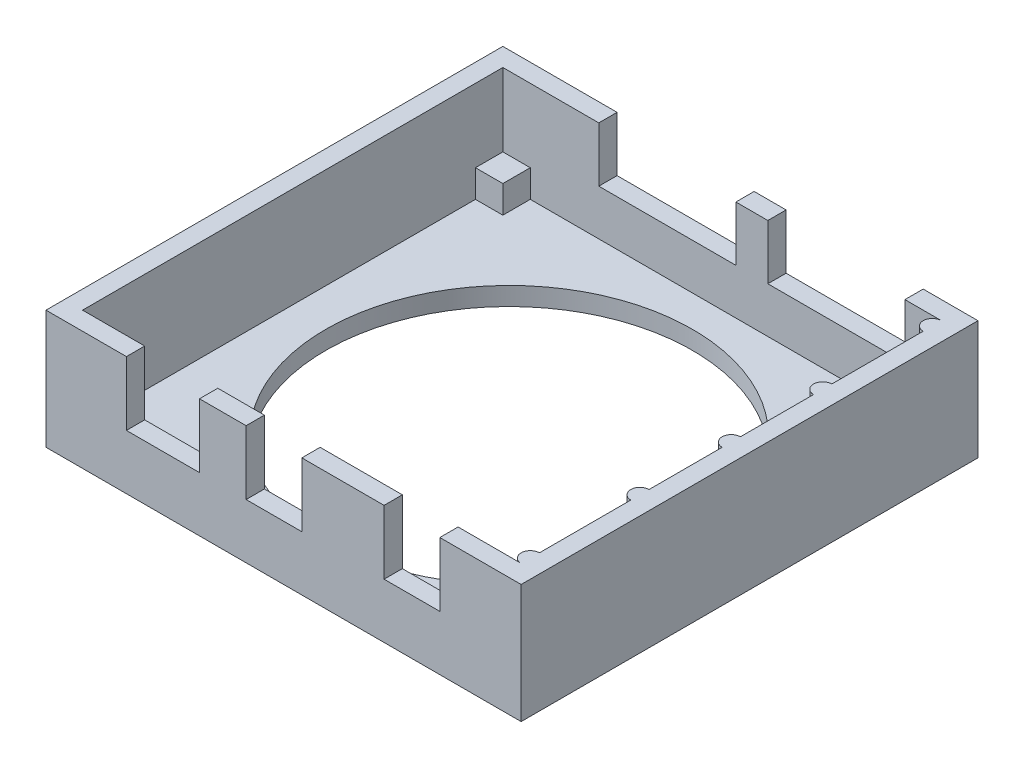
from build123d import *

# Parameters (mm, degrees)
SKETCH1_W           = 52
SKETCH1_H           = 50
BOSS_EXTRUDE1_DEPTH = 13
SKETCH2_W           = 48
SKETCH2_H           = 46
CUT_EXTRUDE1_DEPTH  = 11
SKETCH3_W           = 6.1
SKETCH3_H           = 2
SKETCH3_W_2         = 8
CUT_EXTRUDE2_DEPTH  = 7
SKETCH4_W           = 3
SKETCH4_H           = 3
BOSS_EXTRUDE2_DEPTH = 3
SKETCH5_R           = 1
BOSS_EXTRUDE3_DEPTH = 11
SKETCH13_W          = 15
SKETCH13_H          = 2
CUT_EXTRUDE4_DEPTH  = 6
SKETCH12_R          = 20.065170359
CUT_EXTRUDE3_DEPTH  = 10


with BuildPart() as part:
    # Sketch1 → Boss-Extrude1 (new body)
    with BuildSketch(Plane(origin=(0, 0, 0), x_dir=(1, 0, 0), z_dir=(0, 1, 0))):
        with Locations((26, 25)):
            Rectangle(SKETCH1_W, SKETCH1_H)
    extrude(amount=BOSS_EXTRUDE1_DEPTH)

    # Sketch2 → Cut-Extrude1 (cut)
    with BuildSketch(Plane(origin=(0, 13, 0), x_dir=(1, 0, 0), z_dir=(0, 1, 0))):
        with Locations((26, 25)):
            Rectangle(SKETCH2_W, SKETCH2_H)
    extrude(amount=-CUT_EXTRUDE1_DEPTH, mode=Mode.SUBTRACT)

    # Sketch3 → Cut-Extrude2 (cut)
    with BuildSketch(Plane(origin=(0, 13, 0), x_dir=(1, 0, 0), z_dir=(0, 1, 0))):
        with Locations((40.05, 1)):
            Rectangle(SKETCH3_W, SKETCH3_H)
        with Locations((24.95, 1)):
            Rectangle(SKETCH3_W, SKETCH3_H)
        with Locations((12.8, 1)):
            Rectangle(SKETCH3_W_2, SKETCH3_H)
    extrude(amount=-CUT_EXTRUDE2_DEPTH, mode=Mode.SUBTRACT)

    # Sketch4 → Boss-Extrude2 (add)
    with BuildSketch(Plane(origin=(0, 2, 0), x_dir=(1, 0, 0), z_dir=(0, 1, 0))):
        with Locations((3.5, 46.5)):
            Rectangle(SKETCH4_W, SKETCH4_H)
        with Locations((48.5, 46.5)):
            Rectangle(SKETCH4_W, SKETCH4_H)
        with Locations((3.5, 3.5)):
            Rectangle(SKETCH4_W, SKETCH4_H)
        with Locations((48.5, 3.5)):
            Rectangle(SKETCH4_W, SKETCH4_H)
    extrude(amount=BOSS_EXTRUDE2_DEPTH)

    # Sketch5 → Boss-Extrude3 (add)
    with BuildSketch(Plane(origin=(0, 2, 0), x_dir=(1, 0, 0), z_dir=(0, 1, 0))):
        with Locations((50, 35)):
            Circle(SKETCH5_R)
        with Locations((50, 25)):
            Circle(SKETCH5_R)
        with Locations((50, 15)):
            Circle(SKETCH5_R)
        with Locations((50, 47)):
            Circle(SKETCH5_R)
        with Locations((50, 3)):
            Circle(SKETCH5_R)
    extrude(amount=BOSS_EXTRUDE3_DEPTH)

    # Sketch13 → Cut-Extrude4 (cut)
    with BuildSketch(Plane(origin=(0, 13, 0), x_dir=(1, 0, 0), z_dir=(0, 1, 0))):
        with Locations((38.5, 49)):
            Rectangle(SKETCH13_W, SKETCH13_H)
        with Locations((20, 49)):
            Rectangle(SKETCH13_W, SKETCH13_H)
    extrude(amount=-CUT_EXTRUDE4_DEPTH, mode=Mode.SUBTRACT)

    # Sketch12 → Cut-Extrude3 (cut)
    with BuildSketch(Plane(origin=(0, 2, 0), x_dir=(1, 0, 0), z_dir=(0, 1, 0))):
        with Locations(Location((26.189038813, 24.497096503, 0), (0, 0, 270))):
            Circle(SKETCH12_R)
    extrude(amount=-CUT_EXTRUDE3_DEPTH, mode=Mode.SUBTRACT)


solid = part.part
